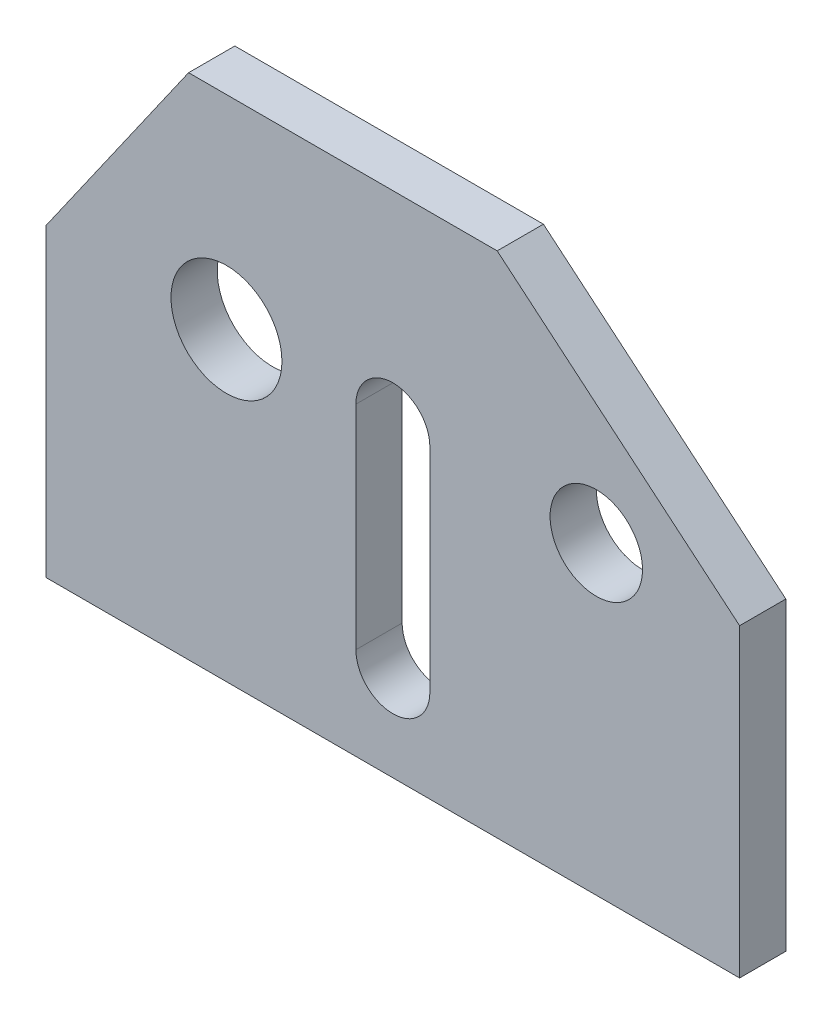
from build123d import *

# Parameters (mm, degrees)
SKETCH1_R           = 6
SKETCH1_R_2         = 5
BOSS_EXTRUDE1_DEPTH = 5


with BuildPart() as part:
    # Sketch1 → Boss-Extrude1 (new body)
    with BuildSketch(Plane.XY):
        Polygon((0, 0), (75, 0), (75, 33), (48.781420963, 55), (15.404565841, 55), (0, 33), align=None)
        with Locations((19.5, 33)):
            Circle(SKETCH1_R, mode=Mode.SUBTRACT)
        with Locations((59.5, 33)):
            Circle(SKETCH1_R_2, mode=Mode.SUBTRACT)
        with BuildLine():
            Line((41.5, 33), (41.5, 10))
            ThreePointArc((41.5, 10), (37.5, 6), (33.5, 10))
            Line((33.5, 10), (33.5, 33))
            ThreePointArc((33.5, 33), (37.5, 37), (41.5, 33))
        make_face(mode=Mode.SUBTRACT)
    extrude(amount=BOSS_EXTRUDE1_DEPTH)


solid = part.part
